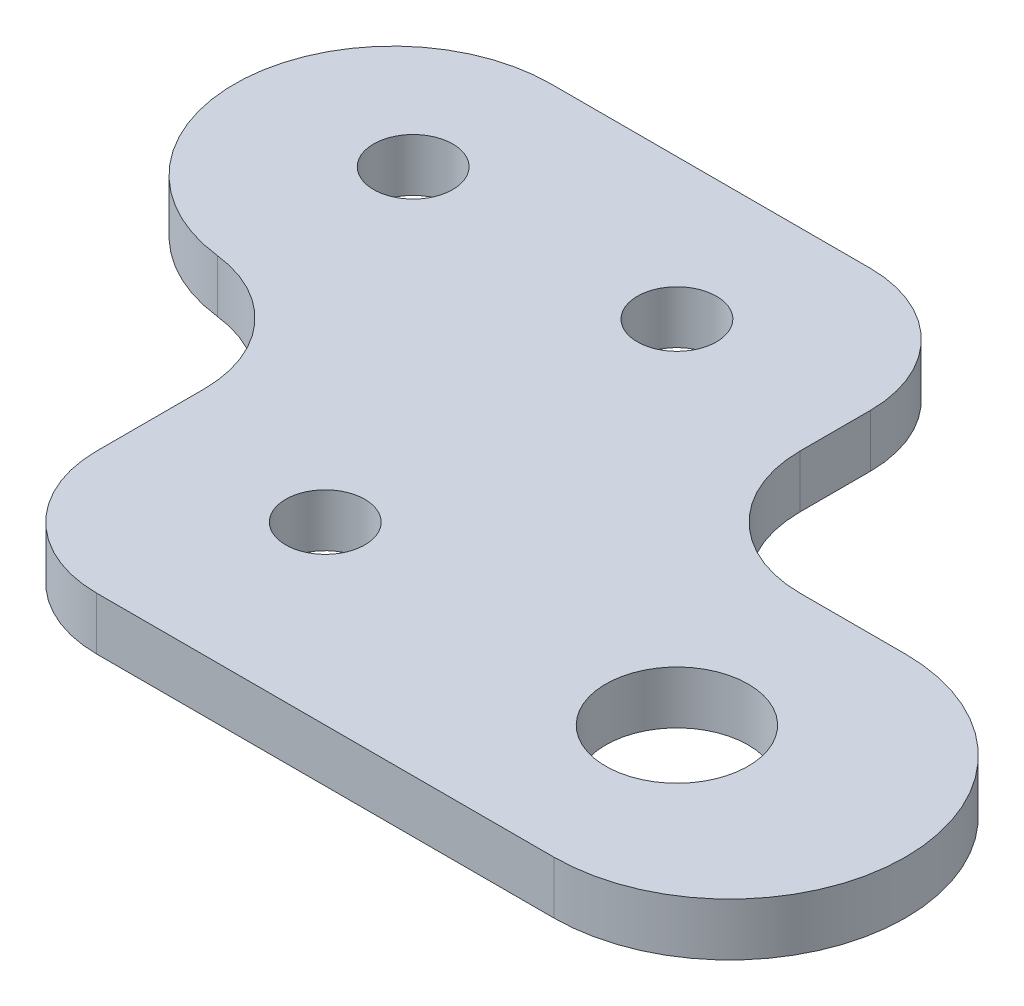
from build123d import *

# Parameters (mm, degrees)
CROQUIS1_R              = 4.05
CROQUIS1_R_2            = 2.25
SALIENTE_EXTRUIR1_DEPTH = 3


with BuildPart() as part:
    # Croquis1 → Saliente-Extruir1 (new body)
    with BuildSketch(Plane(origin=(0, -1.500057886, 0), x_dir=(1, 0, 0), z_dir=(0, 1, 0))):
        with BuildLine():
            Line((-14, -9.893847866), (-14, -16))
            ThreePointArc((-14, -16), (-11.949747468, -20.949747468), (-7, -23))
            Line((-7, -23), (19, -23))
            ThreePointArc((19, -23), (29, -13), (19, -3))
            Line((19, -3), (13, -3))
            ThreePointArc((13, -3), (8.050252532, -0.949747468), (6, 4))
            Line((6, 4), (6, 8))
            ThreePointArc((6, 8), (3.949747468, 12.949747468), (-1, 15))
            Line((-1, 15), (-19.16, 15))
            ThreePointArc((-19.16, 15), (-28.145059956, 6.518360481), (-20.195, -2.940289425))
            ThreePointArc((-20.195, -2.940289425), (-15.773385417, -5.237400723), (-14, -9.893847866))
        make_face()
        with Locations(Location((16, -13, 0), (0, 0, 90))):
            Circle(CROQUIS1_R, mode=Mode.SUBTRACT)
        with Locations(Location((-19, 7, 0), (0, 0, 90))):
            Circle(CROQUIS1_R_2, mode=Mode.SUBTRACT)
        with Locations(Location((-4, -13, 0), (0, 0, 90))):
            Circle(CROQUIS1_R_2, mode=Mode.SUBTRACT)
        with Locations(Location((-4, 7, 0), (0, 0, 90))):
            Circle(CROQUIS1_R_2, mode=Mode.SUBTRACT)
    extrude(amount=-SALIENTE_EXTRUIR1_DEPTH)


solid = part.part
